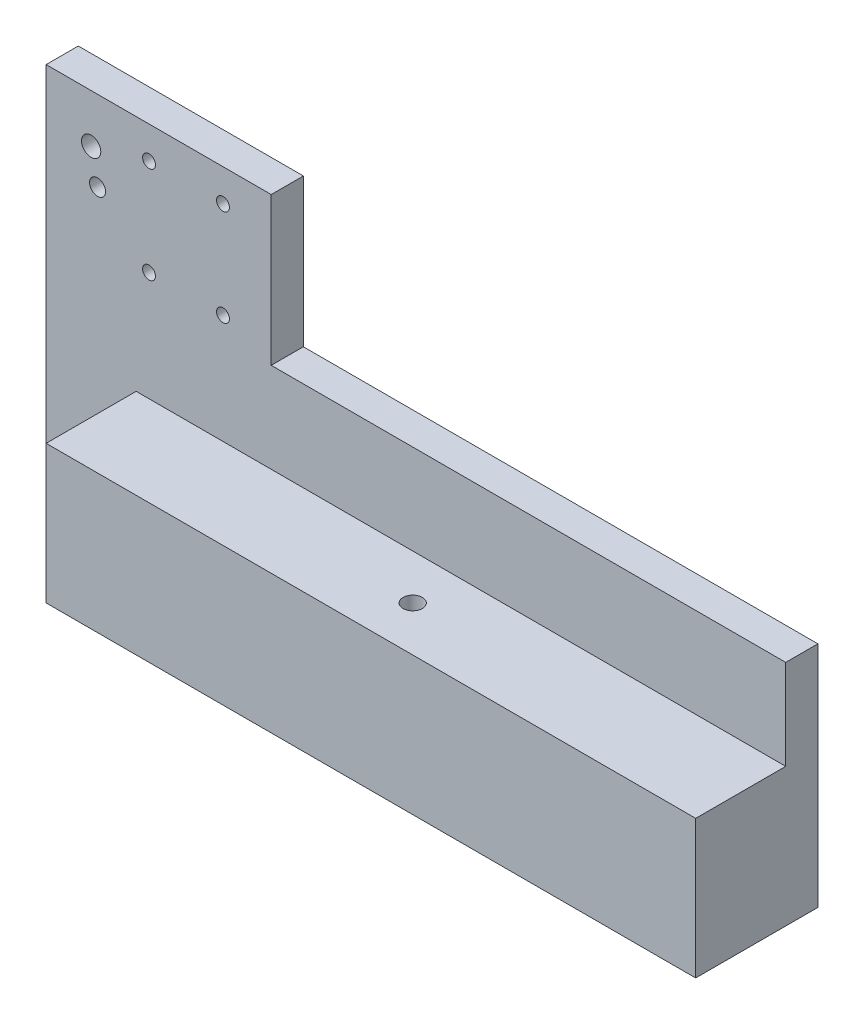
from build123d import *

# Parameters (mm, degrees)
SKETCH2_W           = 230
SKETCH2_H           = 120
BOSS_EXTRUDE1_DEPTH = 38
CUT_EXTRUDE1_DEPTH  = 28
SKETCH4_W           = 160
SKETCH4_H           = 46
CUT_EXTRUDE2_DEPTH  = 261.929109147
SKETCH5_W           = 311.823210218
SKETCH5_H           = 28.846030915
CUT_EXTRUDE3_DEPTH  = 72
SKETCH6_R           = 3
CUT_EXTRUDE4_DEPTH  = 15
SKETCH7_R           = 3
CUT_EXTRUDE5_DEPTH  = 260.563094449
SKETCH8_R           = 2
CUT_EXTRUDE6_DEPTH  = 261.831363145
SKETCH9_R           = 2.5
CUT_EXTRUDE7_DEPTH  = 261.831363145


with BuildPart() as part:
    # Sketch2 → Boss-Extrude1 (new body)
    with BuildSketch(Plane.XY):
        with Locations((115, -60)):
            Rectangle(SKETCH2_W, SKETCH2_H)
    extrude(amount=BOSS_EXTRUDE1_DEPTH)

    # Sketch3 → Cut-Extrude1 (cut)
    with BuildSketch(Plane.XY.offset(38)):
        Polygon((28, -120), (28, -74), (230, -74), (230, 0), (0, 0), (0, -120), align=None)
    extrude(amount=-CUT_EXTRUDE1_DEPTH, mode=Mode.SUBTRACT)

    # Sketch4 → Cut-Extrude2 (cut, through all)
    with BuildSketch(Plane.XY.offset(10)):
        with Locations((150, -23)):
            Rectangle(SKETCH4_W, SKETCH4_H)
    extrude(amount=-CUT_EXTRUDE2_DEPTH, mode=Mode.SUBTRACT)

    # Sketch5 → Cut-Extrude3 (cut)
    with BuildSketch(Plane.XY.offset(38)):
        with Locations((110.708854905, -131.423015458)):
            Rectangle(SKETCH5_W, SKETCH5_H)
    extrude(amount=-CUT_EXTRUDE3_DEPTH, mode=Mode.SUBTRACT)

    # Sketch6 → Cut-Extrude4 (cut)
    with BuildSketch(Plane(origin=(0, -74, 0), x_dir=(1, 0, 0), z_dir=(0, 1, 0))):
        with Locations(Location((128, -24, 0), (0, 0, 270))):
            Circle(SKETCH6_R)
    extrude(amount=-CUT_EXTRUDE4_DEPTH, mode=Mode.SUBTRACT)

    # Sketch7 → Cut-Extrude5 (cut, through all)
    with BuildSketch(Plane.XY.offset(10)):
        with Locations((14, -15)):
            Circle(SKETCH7_R)
        with Locations((14, -102)):
            Circle(SKETCH7_R)
    extrude(amount=-CUT_EXTRUDE5_DEPTH, mode=Mode.SUBTRACT)

    # Sketch8 → Cut-Extrude6 (cut, through all)
    with BuildSketch(Plane(origin=(0, 0, 0), x_dir=(-1, 0, 0), z_dir=(0, 0, -1))):
        with Locations((-55, -10)):
            Circle(SKETCH8_R)
        with Locations((-55, -40)):
            Circle(SKETCH8_R)
        with Locations((-32, -40)):
            Circle(SKETCH8_R)
        with Locations((-32, -10)):
            Circle(SKETCH8_R)
    extrude(amount=-CUT_EXTRUDE6_DEPTH, mode=Mode.SUBTRACT)

    # Sketch9 → Cut-Extrude7 (cut, through all)
    with BuildSketch(Plane(origin=(0, 0, 0), x_dir=(-1, 0, 0), z_dir=(0, 0, -1))):
        with Locations((-16, -25)):
            Circle(SKETCH9_R)
    extrude(amount=-CUT_EXTRUDE7_DEPTH, mode=Mode.SUBTRACT)


solid = part.part
